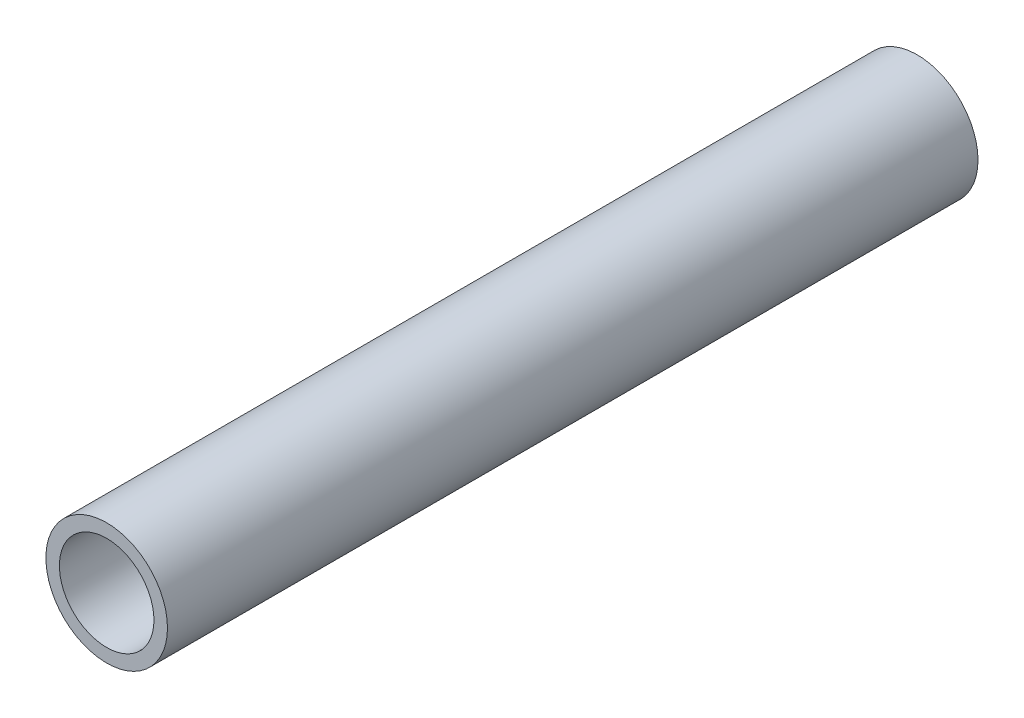
from build123d import *

# Parameters (mm, degrees)
SKETCH1_R           = 4.5
SKETCH1_R_2         = 3.5
BOSS_EXTRUDE1_DEPTH = 60


with BuildPart() as part:
    # Sketch1 → Boss-Extrude1 (new body)
    with BuildSketch(Plane.XY):
        Circle(SKETCH1_R)
        Circle(SKETCH1_R_2, mode=Mode.SUBTRACT)
    extrude(amount=BOSS_EXTRUDE1_DEPTH)


solid = part.part
